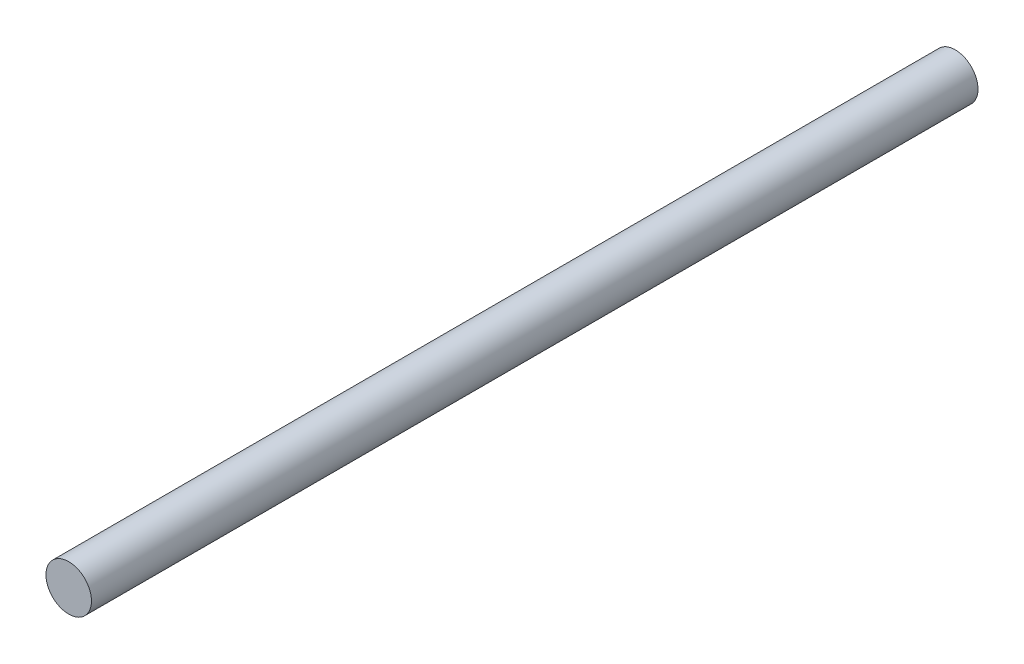
from build123d import *

# Parameters (mm, degrees)
ESBO_O1_R                = 1.35
RESSALTO_EXTRUS_O1_DEPTH = 52.6


with BuildPart() as part:
    # Esboço1 → Ressalto-extrusão1 (new body)
    with BuildSketch(Plane.XY):
        Circle(ESBO_O1_R)
    extrude(amount=RESSALTO_EXTRUS_O1_DEPTH)


solid = part.part
